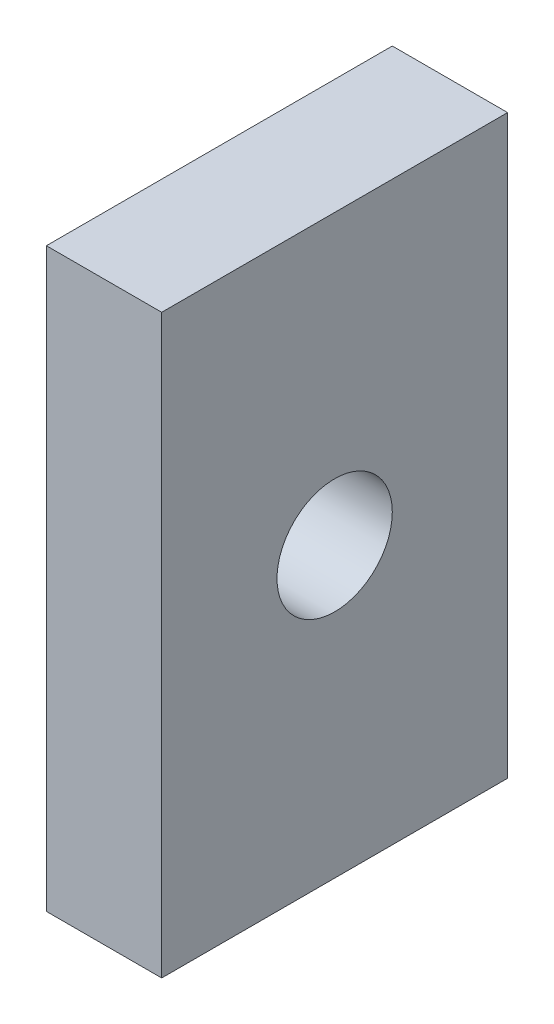
from build123d import *

# Parameters (mm, degrees)
CROQUIS2_W              = 50
CROQUIS2_H              = 30
SALIENTE_EXTRUIR1_DEPTH = 10
CROQUIS3_R              = 5
CORTAR_EXTRUIR1_DEPTH   = 31.822070015


with BuildPart() as part:
    # Croquis2 → Saliente-Extruir1 (new body)
    with BuildSketch(Plane.YZ):
        Rectangle(CROQUIS2_W, CROQUIS2_H)
    extrude(amount=SALIENTE_EXTRUIR1_DEPTH)

    # Croquis3 → Cortar-Extruir1 (cut, through all)
    with BuildSketch(Plane.YZ.offset(10)):
        with Locations(Location((0, 0, 0), (0, 0, 270))):
            Circle(CROQUIS3_R)
    extrude(amount=-CORTAR_EXTRUIR1_DEPTH, mode=Mode.SUBTRACT)


solid = part.part
